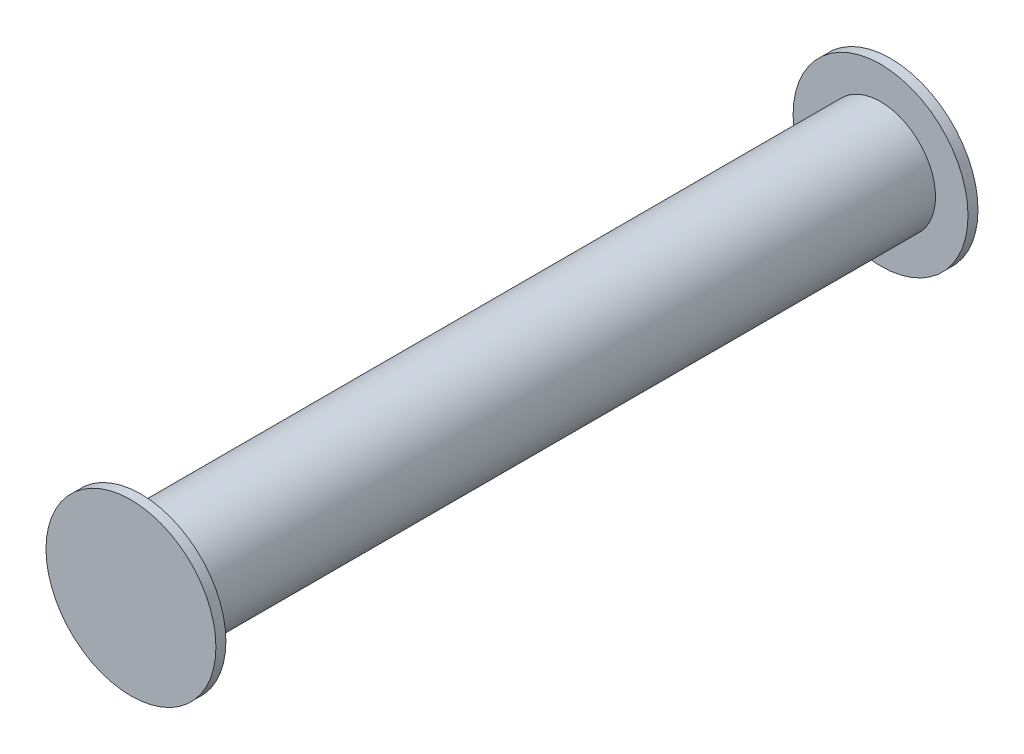
from build123d import *

# Parameters (mm, degrees)
ESQUISSE1_R        = 17.5
BOSS_EXTRU_1_DEPTH = 2
ESQUISSE2_R        = 11
BOSS_EXTRU_2_DEPTH = 150
ESQUISSE3_W        = 6
ESQUISSE3_H        = 2


with BuildPart() as part:
    # Esquisse1 → Boss.-Extru.1 (new body)
    with BuildSketch(Plane.XY):
        Circle(ESQUISSE1_R)
    extrude(amount=BOSS_EXTRU_1_DEPTH)

    # Esquisse2 → Boss.-Extru.2 (add)
    with BuildSketch(Plane.XY.offset(2)):
        Circle(ESQUISSE2_R)
    extrude(amount=BOSS_EXTRU_2_DEPTH)

    # Esquisse3 → Révolution1 (revolve)
    with BuildSketch(Plane(origin=(0, 0, 0), x_dir=(1, 0, 0), z_dir=(0, 1, 0))):
        with Locations((14, -151)):
            Rectangle(ESQUISSE3_W, ESQUISSE3_H)
    revolve(axis=Axis((0, 0, 137.220154247), (0, 0, 1)))


solid = part.part
